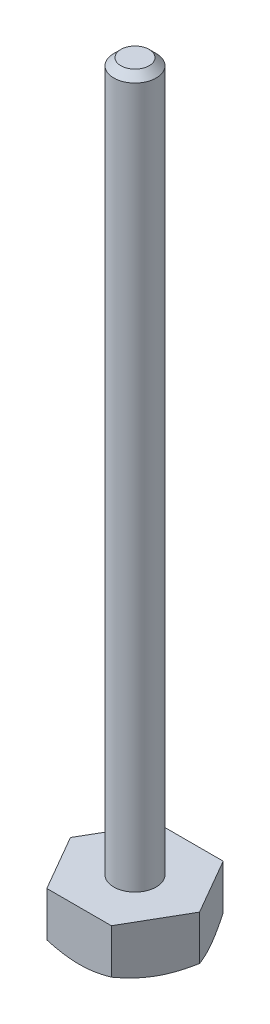
from build123d import *

# Parameters (mm, degrees)
BOSS_EXTRUDE1_DEPTH = 53.5
SKETCH2_OUTSIDE_W   = 22.09
SKETCH2_OUTSIDE_H   = 20.868
SKETCH2_OUTSIDE_R   = 1.5
CUT_EXTRUDE1_DEPTH  = 50
CHAMFER1_SIZE       = 0.5


with BuildPart() as part:
    # Sketch1 → Boss-Extrude1 (new body)
    with BuildSketch(Plane(origin=(0, 0, 0), x_dir=(1, 0, 0), z_dir=(0, 1, 0))):
        Polygon((4.561067127, 0), (2.280533563, 3.95), (-2.280533563, 3.95), (-4.561067127, 0), (-2.280533563, -3.95), (2.280533563, -3.95), align=None)
    extrude(amount=BOSS_EXTRUDE1_DEPTH)

    # Sketch2 outside → Cut-Extrude1 (cut)
    with BuildSketch(Plane(origin=(0, 53.5, 0), x_dir=(1, 0, 0), z_dir=(0, 1, 0))):
        Rectangle(SKETCH2_OUTSIDE_W, SKETCH2_OUTSIDE_H)
        with Locations(Location((0, 0, 0), (0, 0, 270))):
            Circle(SKETCH2_OUTSIDE_R, mode=Mode.SUBTRACT)
    extrude(amount=-CUT_EXTRUDE1_DEPTH, mode=Mode.SUBTRACT)

    # Sketch3 → Cut-Revolve1 (revolve, cut)
    with BuildSketch(Plane(origin=(0, 0, 0), x_dir=(0, 0, -1), z_dir=(1, 0, 0))):
        Polygon((3.95, 0), (5.249038106, 0.75), (5.249038106, -0.75), align=None)
    revolve(axis=Axis((0, 3.5, 0), (0, 1, 0)), mode=Mode.SUBTRACT)

    # Chamfer1
    chamfer1_edges = [part.edges().sort_by_distance(p)[0] for p in [
        (0, 53.5, -1.5),
    ]]
    chamfer(chamfer1_edges, length=CHAMFER1_SIZE)


solid = part.part
